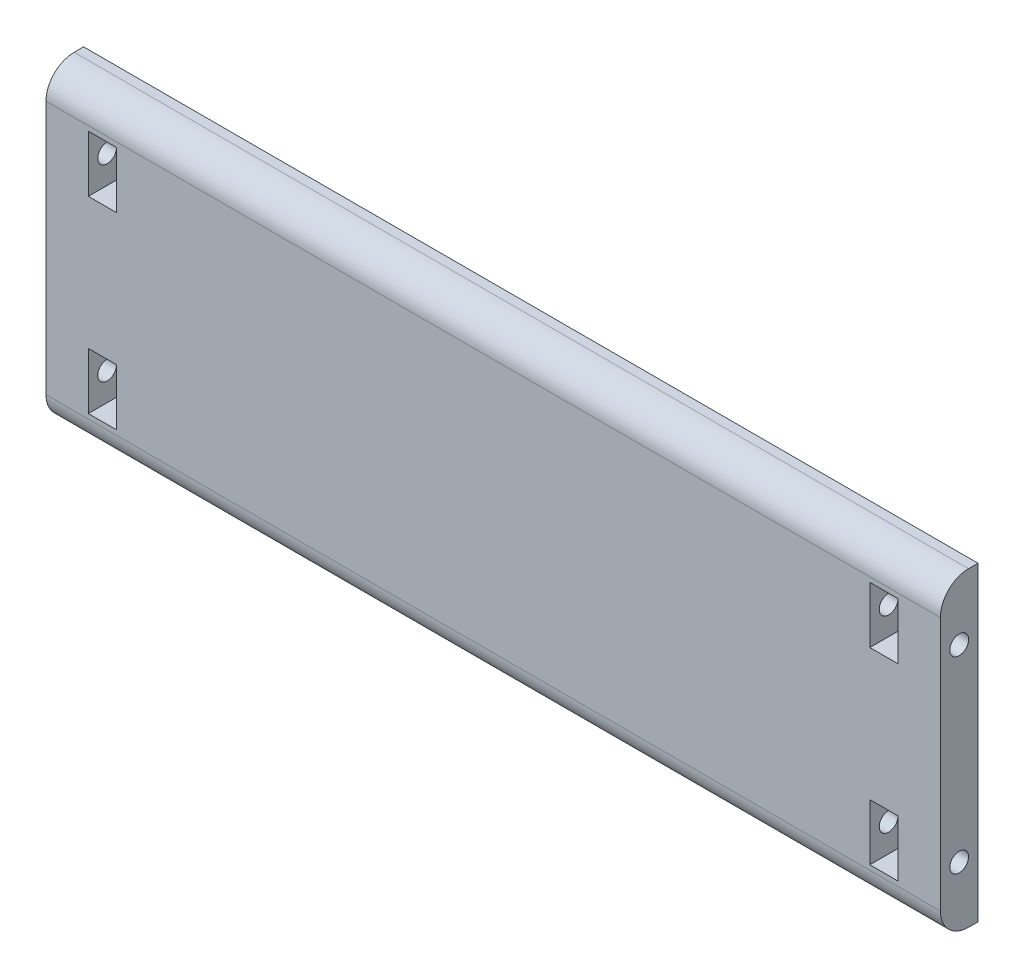
from build123d import *

# Parameters (mm, degrees)
ESQUISSE1_W             = 95.08
ESQUISSE1_H             = 33.02
ESQUISSE1_W_2           = 3
ESQUISSE1_H_2           = 6
BOSS_EXTRU_1_DEPTH      = 4
CONG_1_R                = 3
ESQUISSE4_R             = 1
ENL_V_MAT_EXTRU_2_DEPTH = 10
ENL_V_START             = -10
ESQUISSE5_R             = 1
ENL_V_MAT_EXTRU_3_DEPTH = 10


with BuildPart() as part:
    # Esquisse1 → Boss.-Extru.1 (new body)
    with BuildSketch(Plane.XY):
        Rectangle(ESQUISSE1_W, ESQUISSE1_H)
        with Locations((-41.54, -10)):
            Rectangle(ESQUISSE1_W_2, ESQUISSE1_H_2, mode=Mode.SUBTRACT)
        with Locations((-41.54, 10)):
            Rectangle(ESQUISSE1_W_2, ESQUISSE1_H_2, mode=Mode.SUBTRACT)
        with Locations((41.54, -10)):
            Rectangle(ESQUISSE1_W_2, ESQUISSE1_H_2, mode=Mode.SUBTRACT)
        with Locations((41.54, 10)):
            Rectangle(ESQUISSE1_W_2, ESQUISSE1_H_2, mode=Mode.SUBTRACT)
    extrude(amount=BOSS_EXTRU_1_DEPTH)

    # Congé1
    cong_1_edges = [part.edges().sort_by_distance(p)[0] for p in [
        (0, -16.51, 4),
        (0, 16.51, 4),
    ]]
    fillet(cong_1_edges, radius=CONG_1_R)

    # Esquisse4 → Enlèv. mat.-Extru.2 (cut)
    with BuildSketch(Plane(origin=(47.54, 0, 0), x_dir=(0, 0, -1), z_dir=(1, 0, 0))):
        with Locations(Location((-2, 10, 0), (0, 0, 90))):
            Circle(ESQUISSE4_R)
        with Locations(Location((-2, -10, 0), (0, 0, 90))):
            Circle(ESQUISSE4_R)
    extrude(amount=-ENL_V_MAT_EXTRU_2_DEPTH, mode=Mode.SUBTRACT)

    # Esquisse5 → Enlèv. mat.-Extru.3 (cut)
    with BuildSketch(Plane.ZY.offset(47.54).offset(ENL_V_START)):
        with Locations(Location((2, 10, 0), (0, 0, 90))):
            Circle(ESQUISSE5_R)
        with Locations(Location((2, -10, 0), (0, 0, 90))):
            Circle(ESQUISSE5_R)
    extrude(amount=ENL_V_MAT_EXTRU_3_DEPTH, mode=Mode.SUBTRACT)


solid = part.part
